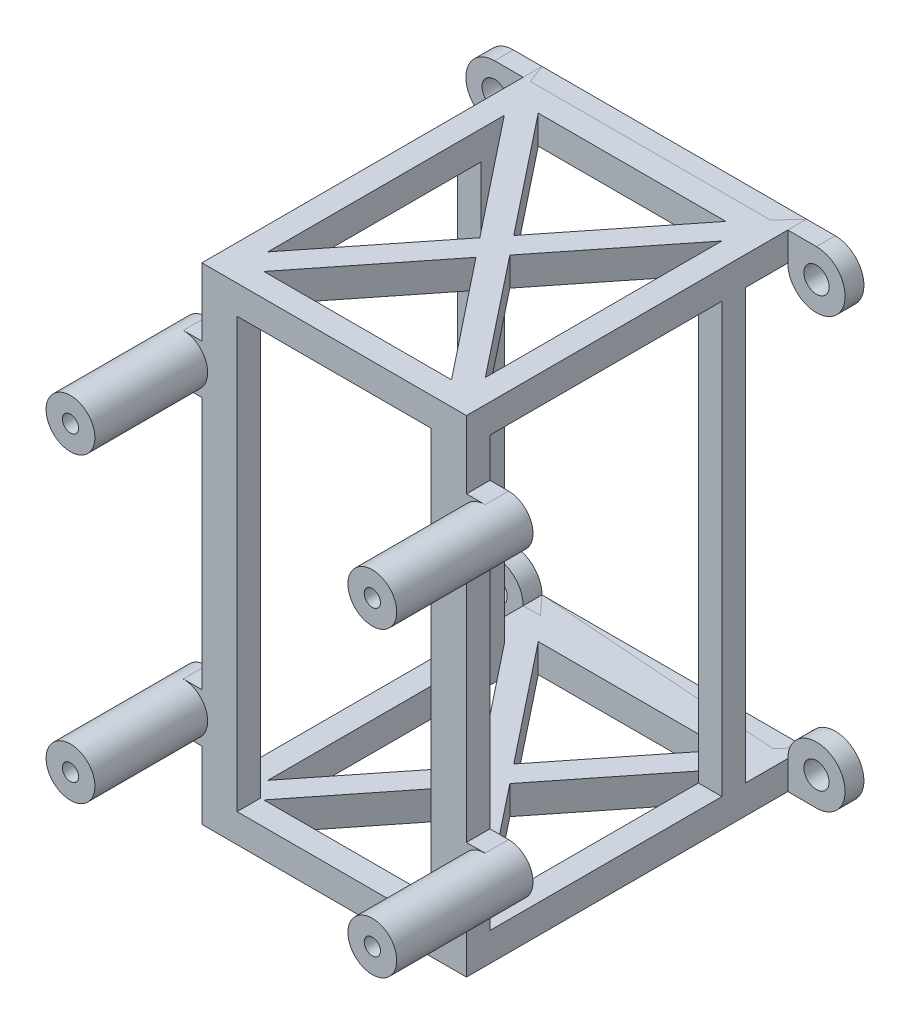
from build123d import *
from build123d.topology import SkipClean

# Parameters (mm, degrees)
SKETCH1_R             = 1.7018
BOSS_EXTRUDE2_DEPTH   = 2.54
BOSS_EXTRUDE2_2_DEPTH = 2.54
BOSS_EXTRUDE3_START   = -2.54
SKETCH2_W             = 35.7632
SKETCH2_H             = 3.8735
BOSS_EXTRUDE3_DEPTH   = 45.974
BOSS_EXTRUDE3_2_DEPTH = 45.974
CUT_EXTRUDE3_DEPTH    = 85.211343256
BOSS_EXTRUDE4_START   = 45.974
SKETCH7_R             = 1.099947
BOSS_EXTRUDE4_DEPTH   = 3.175
SKETCH8_R             = 3.299841
SKETCH8_R_2           = 1.099947
BOSS_EXTRUDE5_DEPTH   = 15.24
BOSS_EXTRUDE6_START   = -3.8735
SKETCH9_W             = 3.175
SKETCH9_H             = 3.175
BOSS_EXTRUDE6_DEPTH   = 57.9882


with BuildPart() as part:
    # Sketch1 → Boss-Extrude2 (new body)
    with BuildSketch(Plane.XY):
        with BuildLine():
            Line((21.7551, 32.8676), (-21.7551, 32.8676))
            ThreePointArc((-21.7551, 32.8676), (-24.494078117, 26.255121883), (-17.8816, 28.9941))
            Line((-17.8816, 28.9941), (17.8816, 28.9941))
            ThreePointArc((17.8816, 28.9941), (24.494078117, 26.255121883), (21.7551, 32.8676))
        make_face()
        with Locations((-21.7551, 28.9941)):
            Circle(SKETCH1_R, mode=Mode.SUBTRACT)
        with Locations((21.7551, 28.9941)):
            Circle(SKETCH1_R, mode=Mode.SUBTRACT)
    extrude(amount=BOSS_EXTRUDE2_DEPTH)


with BuildPart() as body_2:
    # Sketch1 → Boss-Extrude2 2 (new body)
    with BuildSketch(Plane.XY):
        with BuildLine():
            Line((17.8816, -28.9941), (-17.8816, -28.9941))
            ThreePointArc((-17.8816, -28.9941), (-24.494078117, -26.255121883), (-21.7551, -32.8676))
            Line((-21.7551, -32.8676), (21.7551, -32.8676))
            ThreePointArc((21.7551, -32.8676), (24.494078117, -26.255121883), (17.8816, -28.9941))
        make_face()
        with Locations((-21.7551, -28.9941)):
            Circle(SKETCH1_R, mode=Mode.SUBTRACT)
        with Locations((21.7551, -28.9941)):
            Circle(SKETCH1_R, mode=Mode.SUBTRACT)
    extrude(amount=BOSS_EXTRUDE2_2_DEPTH)


with BuildPart() as body_3:
    # Sketch2 → Boss-Extrude3 (new body)
    with BuildSketch(Plane.XY.offset(2.54).offset(BOSS_EXTRUDE3_START)):
        with Locations((0, 30.93085)):
            Rectangle(SKETCH2_W, SKETCH2_H)
    extrude(amount=BOSS_EXTRUDE3_DEPTH)


with BuildPart() as body_4:
    # Sketch2 → Boss-Extrude3 2 (new body)
    with BuildSketch(Plane.XY.offset(2.54).offset(BOSS_EXTRUDE3_START)):
        with Locations((0, -30.93085)):
            Rectangle(SKETCH2_W, SKETCH2_H)
    extrude(amount=BOSS_EXTRUDE3_2_DEPTH)


with BuildPart() as cut_extrude3_tool:
    # Sketch6 → Cut-Extrude3 (new, through all)
    with BuildSketch(Plane(origin=(0, 32.8676, 0), x_dir=(1, 0, 0), z_dir=(0, 1, 0))):
        Polygon((-14.7066, -40.244356495), (-2.026217246, -24.257), (-14.7066, -8.269643505), align=None)
        Polygon((-12.680382754, -5.715), (0, -21.702356495), (12.680382754, -5.715), align=None)
        Polygon((14.7066, -8.269643505), (2.026217246, -24.257), (14.7066, -40.244356495), align=None)
        Polygon((0, -26.811643505), (-12.680382754, -42.799), (12.680382754, -42.799), align=None)
    extrude(amount=-CUT_EXTRUDE3_DEPTH)


with BuildPart() as body_3_1:
    add(body_3.part)

    # Cut-Extrude3: cut by cut_extrude3_tool
    add(cut_extrude3_tool.part, mode=Mode.SUBTRACT)



with BuildPart() as body_4_1:
    add(body_4.part)

    # Cut-Extrude3: cut by cut_extrude3_tool
    add(cut_extrude3_tool.part, mode=Mode.SUBTRACT)


with BuildPart() as body_3_2:
    add(body_3_1.part)

    add(body_4_1.part)  # Boss-Extrude4 merges body 4
    # Sketch7 → Boss-Extrude4 (add)
    # profile 1 of 2: a face of its own
    with BuildSketch(Plane.XY.offset(BOSS_EXTRUDE4_START)):
        with BuildLine():
            Line((-13.1191, -32.8676), (-13.1191, 32.8676))
            Line((-13.1191, 32.8676), (-17.8816, 32.8676))
            Line((-17.8816, 32.8676), (-17.8816, 23.699851))
            Line((-17.8816, 23.699851), (-20.40001, 23.699851))
            ThreePointArc((-20.40001, 23.699851), (-23.699851, 20.40001), (-20.40001, 17.100169))
            Line((-20.40001, 17.100169), (-17.8816, 17.100169))
            Line((-17.8816, 17.100169), (-17.8816, -17.100169))
            Line((-17.8816, -17.100169), (-20.40001, -17.100169))
            ThreePointArc((-20.40001, -17.100169), (-23.699851, -20.40001), (-20.40001, -23.699851))
            Line((-20.40001, -23.699851), (-17.8816, -23.699851))
            Line((-17.8816, -23.699851), (-17.8816, -32.8676))
            Line((-17.8816, -32.8676), (-13.1191, -32.8676))
        make_face()
        with Locations((-20.40001, -20.40001)):
            Circle(SKETCH7_R, mode=Mode.SUBTRACT)
        with Locations((-20.40001, 20.40001)):
            Circle(SKETCH7_R, mode=Mode.SUBTRACT)
    # profile 2 of 2: a face of its own
    with BuildSketch(Plane.XY.offset(BOSS_EXTRUDE4_START)):
        with BuildLine():
            Line((17.8816, 32.8676), (13.1191, 32.8676))
            Line((13.1191, 32.8676), (13.1191, -32.8676))
            Line((13.1191, -32.8676), (17.8816, -32.8676))
            Line((17.8816, -32.8676), (17.8816, -23.699851))
            Line((17.8816, -23.699851), (20.40001, -23.699851))
            ThreePointArc((20.40001, -23.699851), (23.699851, -20.40001), (20.40001, -17.100169))
            Line((20.40001, -17.100169), (17.8816, -17.100169))
            Line((17.8816, -17.100169), (17.8816, 17.100169))
            Line((17.8816, 17.100169), (20.40001, 17.100169))
            ThreePointArc((20.40001, 17.100169), (23.699851, 20.40001), (20.40001, 23.699851))
            Line((20.40001, 23.699851), (17.8816, 23.699851))
            Line((17.8816, 23.699851), (17.8816, 32.8676))
        make_face()
        with Locations((20.40001, 20.40001)):
            Circle(SKETCH7_R, mode=Mode.SUBTRACT)
        with Locations((20.40001, -20.40001)):
            Circle(SKETCH7_R, mode=Mode.SUBTRACT)
    extrude(amount=-BOSS_EXTRUDE4_DEPTH)

    # Sketch8 → Boss-Extrude5 (add)
    # profile 1 of 4: a face of its own
    with SkipClean():  # the faces are left unmerged after this step: merging them gives an invalid solid
        with BuildSketch(Plane.XY.offset(45.974)):
            with Locations((-20.40001, 20.40001)):
                Circle(SKETCH8_R)
            with Locations((-20.40001, 20.40001)):
                Circle(SKETCH8_R_2, mode=Mode.SUBTRACT)
        # profile 2 of 4: a face of its own
        with BuildSketch(Plane.XY.offset(45.974)):
            with Locations((20.40001, 20.40001)):
                Circle(SKETCH8_R)
            with Locations((20.40001, 20.40001)):
                Circle(SKETCH8_R_2, mode=Mode.SUBTRACT)
        # profile 3 of 4: a face of its own
        with BuildSketch(Plane.XY.offset(45.974)):
            with Locations((20.40001, -20.40001)):
                Circle(SKETCH8_R)
            with Locations((20.40001, -20.40001)):
                Circle(SKETCH8_R_2, mode=Mode.SUBTRACT)
        # profile 4 of 4: a face of its own
        with BuildSketch(Plane.XY.offset(45.974)):
            with Locations((-20.40001, -20.40001)):
                Circle(SKETCH8_R)
            with Locations((-20.40001, -20.40001)):
                Circle(SKETCH8_R_2, mode=Mode.SUBTRACT)
        extrude(amount=BOSS_EXTRUDE5_DEPTH)

    # Sketch9 → Boss-Extrude6 (add)
    with SkipClean():  # the faces are left unmerged after this step: merging them gives an invalid solid
        with BuildSketch(Plane(origin=(0, 32.8676, 0), x_dir=(1, 0, 0), z_dir=(0, 1, 0)).offset(BOSS_EXTRUDE6_START)):
            with Locations((-16.2941, -9.857143505)):
                Rectangle(SKETCH9_W, SKETCH9_H)
            with Locations((16.2941, -9.857143505)):
                Rectangle(SKETCH9_W, SKETCH9_H)
        extrude(amount=-BOSS_EXTRUDE6_DEPTH)


solid = Compound([part.part, body_2.part, body_3_2.part])
